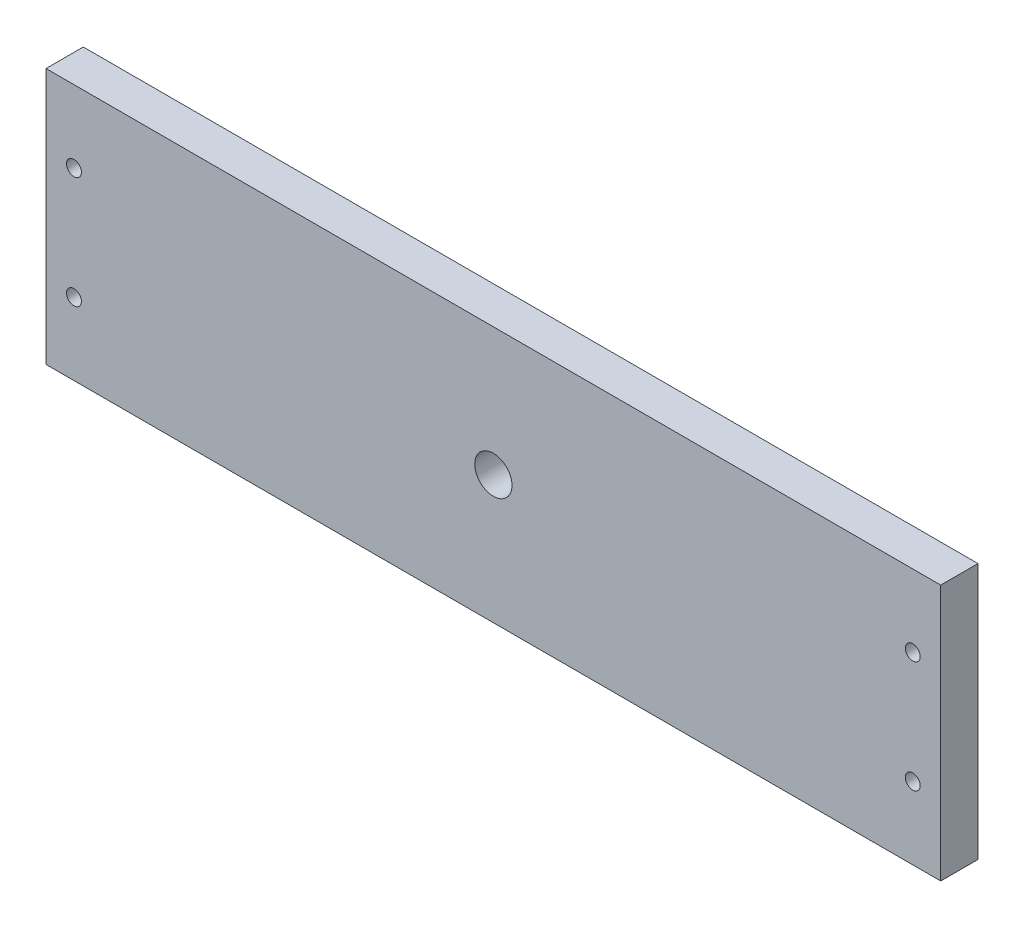
from build123d import *

# Parameters (mm, degrees)
SKETCH1_W           = 192
SKETCH1_H           = 55
BOSS_EXTRUDE1_DEPTH = 8
SKETCH2_R           = 4
SKETCH2_R_2         = 1.6
CUT_EXTRUDE2_DEPTH  = 9


with BuildPart() as part:
    # Sketch1 → Boss-Extrude1 (new body)
    with BuildSketch(Plane.XY):
        Rectangle(SKETCH1_W, SKETCH1_H)
    extrude(amount=BOSS_EXTRUDE1_DEPTH)

    # Sketch2 → Cut-Extrude2 (cut)
    with BuildSketch(Plane.XY):
        with Locations(Location((0, 0, 0), (0, 0, 180))):
            Circle(SKETCH2_R)
        with Locations(Location((-90, 12, 0), (0, 0, 180))):
            Circle(SKETCH2_R_2)
        with Locations(Location((-90, -12, 0), (0, 0, 180))):
            Circle(SKETCH2_R_2)
        with Locations(Location((90, 12, 0), (0, 0, 180))):
            Circle(SKETCH2_R_2)
        with Locations(Location((90, -12, 0), (0, 0, 180))):
            Circle(SKETCH2_R_2)
    extrude(amount=CUT_EXTRUDE2_DEPTH, mode=Mode.SUBTRACT)


solid = part.part
